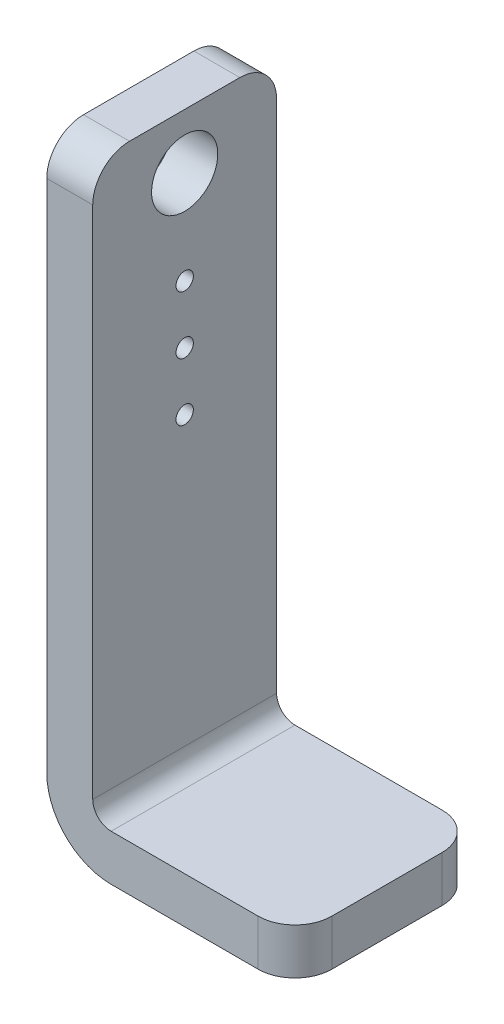
from build123d import *

# Parameters (mm, degrees)
BOSS_EXTRUDE1_DEPTH = 12.7
CUT_EXTRUDE1_REACH  = 35.917
SKETCH2_R           = 2.286
SKETCH2_R_2         = 0.6
FILLET1_R           = 2.54


with BuildPart() as part:
    # Sketch1 → Boss-Extrude1 (new body)
    with BuildSketch(Plane.XY):
        with BuildLine():
            Line((0, 26.364540169), (0, -11.735459831))
            ThreePointArc((0, -11.735459831), (0.371974388, -12.633485443), (1.27, -13.005459831))
            Line((1.27, -13.005459831), (13.97, -13.005459831))
            Line((13.97, -13.005459831), (13.97, -16.180459831))
            Line((13.97, -16.180459831), (1.27, -16.180459831))
            ThreePointArc((1.27, -16.180459831), (-1.873089642, -14.878549473), (-3.175, -11.735459831))
            Line((-3.175, -11.735459831), (-3.175, 26.364540169))
            Line((-3.175, 26.364540169), (0, 26.364540169))
        make_face()
    extrude(amount=BOSS_EXTRUDE1_DEPTH)

    # Sketch2 → Cut-Extrude1 (cut, up to next)
    with BuildSketch(Plane.ZY.offset(3.175), mode=Mode.PRIVATE) as cut_extrude1_sk1:
        with Locations((6.35, 22.554540169)):
            Circle(SKETCH2_R)
    cut_extrude1_tool1 = extrude(cut_extrude1_sk1.sketch, amount=-CUT_EXTRUDE1_REACH, mode=Mode.PRIVATE) & part.part
    # Sketch2 → Cut-Extrude1 (cut, up to next)
    with BuildSketch(Plane.ZY.offset(3.175), mode=Mode.PRIVATE) as cut_extrude1_sk2:
        with Locations((6.35, 16.104540169)):
            Circle(SKETCH2_R_2)
    cut_extrude1_tool2 = extrude(cut_extrude1_sk2.sketch, amount=-CUT_EXTRUDE1_REACH, mode=Mode.PRIVATE) & part.part
    # Sketch2 → Cut-Extrude1 (cut, up to next)
    with BuildSketch(Plane.ZY.offset(3.175), mode=Mode.PRIVATE) as cut_extrude1_sk3:
        with Locations((6.35, 12.104540169)):
            Circle(SKETCH2_R_2)
    cut_extrude1_tool3 = extrude(cut_extrude1_sk3.sketch, amount=-CUT_EXTRUDE1_REACH, mode=Mode.PRIVATE) & part.part
    # Sketch2 → Cut-Extrude1 (cut, up to next)
    with BuildSketch(Plane.ZY.offset(3.175), mode=Mode.PRIVATE) as cut_extrude1_sk4:
        with Locations((6.35, 8.104540169)):
            Circle(SKETCH2_R_2)
    cut_extrude1_tool4 = extrude(cut_extrude1_sk4.sketch, amount=-CUT_EXTRUDE1_REACH, mode=Mode.PRIVATE) & part.part
    add(cut_extrude1_tool1.solids().sort_by_distance((-3.175, 22.55454, 6.35))[0], mode=Mode.SUBTRACT)
    add(cut_extrude1_tool2.solids().sort_by_distance((-3.175, 16.10454, 6.35))[0], mode=Mode.SUBTRACT)
    add(cut_extrude1_tool3.solids().sort_by_distance((-3.175, 12.10454, 6.35))[0], mode=Mode.SUBTRACT)
    add(cut_extrude1_tool4.solids().sort_by_distance((-3.175, 8.10454, 6.35))[0], mode=Mode.SUBTRACT)

    # Fillet1
    fillet1_edges = [part.edges().sort_by_distance(p)[0] for p in [
        (13.97, -14.592959831, 0),
        (13.97, -14.592959831, 12.7),
        (-1.5875, 26.364540169, 0),
        (-1.5875, 26.364540169, 12.7),
    ]]
    fillet(fillet1_edges, radius=FILLET1_R)


solid = part.part
